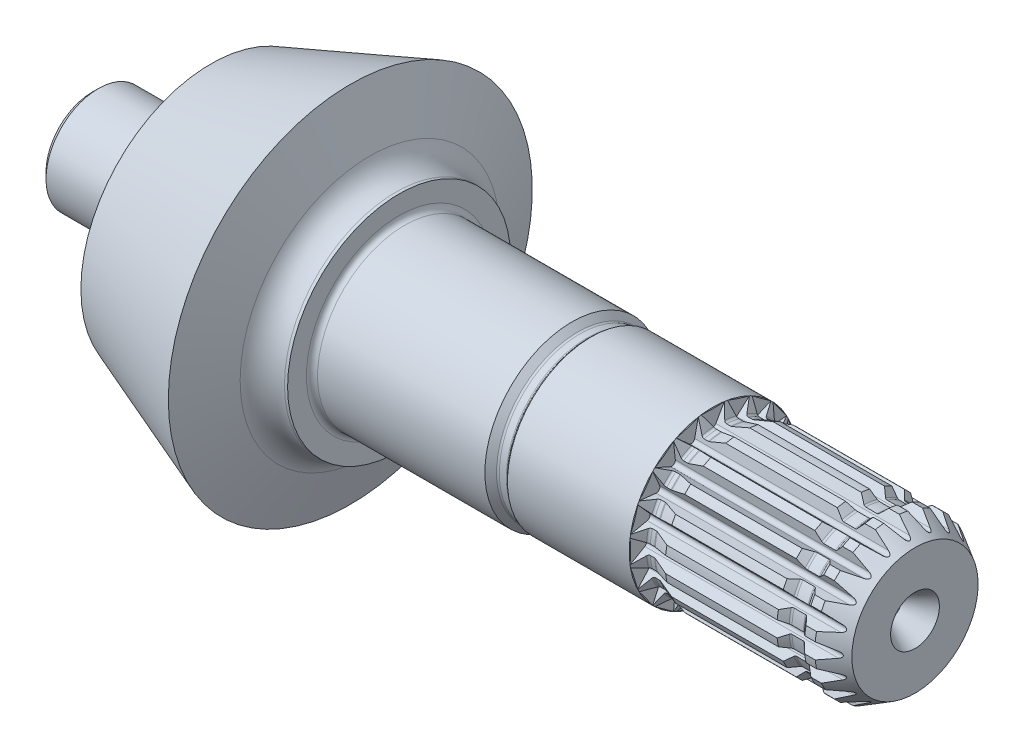
from build123d import *

# Parameters (mm, degrees)
CANNELURE_ROUL_E_DEPTH = 29
F_20_CANNELURES_COUNT  = 20
PER_AGE2_D             = 3
PER_AGE2_DEPTH         = 6
PER_AGE2_CSINK_D       = 6
PER_AGE2_CSINK_ANGLE   = 60
PER_AGE2_TIP           = 0.866025404
PER_AGE3_D             = 3
PER_AGE3_DEPTH         = 8
PER_AGE3_CSINK_D       = 7
PER_AGE3_CSINK_ANGLE   = 60
PER_AGE3_TIP           = 0.866025404


with BuildPart() as part:
    # Esquisse1 → bauche pignon (revolve)
    with BuildSketch(Plane.XY, mode=Mode.PRIVATE) as bauche_pignon_sk:
        with BuildLine():
            Line((-9.286495037, 10), (7.713504963, 10))
            Line((7.713504963, 10), (7.713504963, 18.647686147))
            Line((7.713504963, 18.647686147), (27.713504963, 26.106760606))
            Line((27.713504963, 26.106760606), (30.512346811, 18.602232094))
            ThreePointArc((30.512346811, 18.602232094), (31.978849357, 16.71434393), (34.260178835, 16))
            Line((34.260178835, 16), (108.713504963, 16))
            Line((108.713504963, 16), (108.713504963, 0))
            Line((108.713504963, 0), (-9.286495037, 0))
            Line((-9.286495037, 0), (-9.286495037, 10))
        make_face()
    revolve(bauche_pignon_sk.sketch.rotate(Axis((0, 0, 0), (1, 0, 0)), 85.548664013), axis=Axis((0, 0, 0), (1, 0, 0)))

    # profil tournage queue → tournage queue (revolve, cut)
    with BuildSketch(Plane.XY, mode=Mode.PRIVATE) as tournage_queue_sk:
        with BuildLine():
            Line((34.713504963, 20.351720967), (34.713504963, 13.3))
            ThreePointArc((34.713504963, 13.3), (34.947819538, 12.734314575), (35.513504963, 12.5))
            Line((35.513504963, 12.5), (59.513504963, 12.5))
            Line((59.513504963, 12.5), (60.347203715, 11.666301248))
            ThreePointArc((60.347203715, 11.666301248), (60.476973055, 11.579592147), (60.630046428, 11.54914396))
            Line((60.630046428, 11.54914396), (61.630046428, 11.54914396))
            ThreePointArc((61.630046428, 11.54914396), (61.780299945, 11.57843669), (61.908546784, 11.662024558))
            Line((61.908546784, 11.662024558), (62.256981911, 12))
            Line((62.256981911, 12), (79.713504963, 12))
            Line((79.713504963, 12), (80.617568488, 10.434116042))
            ThreePointArc((80.617568488, 10.434116042), (80.763978649, 10.287705881), (80.963978649, 10.234116042))
            Line((80.963978649, 10.234116042), (81.57132891, 10.234116042))
            ThreePointArc((81.57132891, 10.234116042), (81.636706077, 10.239494925), (81.700324963, 10.255486912))
            Line((81.700324963, 10.255486912), (83.885619278, 11))
            Line((83.885619278, 11), (99.885619278, 11))
            Line((99.885619278, 11), (100.768461991, 10.117157288))
            ThreePointArc((100.768461991, 10.117157288), (100.89823133, 10.030448187), (101.051304703, 10))
            Line((101.051304703, 10), (102.681325933, 10))
            ThreePointArc((102.681325933, 10), (102.834399306, 10.030448187), (102.964168646, 10.117157288))
            Line((102.964168646, 10.117157288), (103.847011358, 11))
            Line((103.847011358, 11), (105.347011358, 11))
            Line((105.347011358, 11), (111.530048212, 7.430222008))
            Line((111.530048212, 7.430222008), (114.713504963, 7.430222008))
            Line((114.713504963, 7.430222008), (114.713504963, 20.351720967))
            Line((114.713504963, 20.351720967), (34.713504963, 20.351720967))
        make_face()
    revolve(tournage_queue_sk.sketch.rotate(Axis((130.23818408, 0, 0), (-1, 0, 0)), 274.451335987), axis=Axis((130.23818408, 0, 0), (-1, 0, 0)), mode=Mode.SUBTRACT)

    # profil avant → contournage avant pignon (revolve, cut)
    with BuildSketch(Plane.XY, mode=Mode.PRIVATE) as contournage_avant_pignon_sk:
        with BuildLine():
            Line((7.213504963, 10.581122951), (7.713504963, 11.081122951))
            Line((7.713504963, 11.081122951), (7.713504963, 22.274596763))
            Line((7.713504963, 22.274596763), (-12.286495037, 22.274596763))
            Line((-12.286495037, 22.274596763), (-12.286495037, 6))
            Line((-12.286495037, 6), (-9.93921977, 6))
            Line((-9.93921977, 6), (-8.43921977, 7.5))
            Line((-8.43921977, 7.5), (6.06078023, 7.5))
            Line((6.06078023, 7.5), (6.06078023, 8.5))
            Line((6.06078023, 8.5), (6.213504963, 8.5))
            ThreePointArc((6.213504963, 8.5), (6.920611744, 8.792893219), (7.213504963, 9.5))
            Line((7.213504963, 9.5), (7.213504963, 10.581122951))
        make_face()
    revolve(contournage_avant_pignon_sk.sketch.rotate(Axis((2.057051701, 0, 0), (1, 0, 0)), 85.548664013), axis=Axis((2.057051701, 0, 0), (1, 0, 0)), mode=Mode.SUBTRACT)

    # section cannelure → cannelure roulée (cut)
    with BuildSketch(Plane(origin=(108.713504963, 0, 0), x_dir=(0, 0, -1), z_dir=(1, 0, 0))):
        with BuildLine():
            Line((0.433012702, 9.75), (1.657867208, 11.871510236))
            Line((1.657867208, 11.871510236), (-1.657867208, 11.871510236))
            Line((-1.657867208, 11.871510236), (-0.433012702, 9.75))
            ThreePointArc((-0.433012702, 9.75), (0, 9.5), (0.433012702, 9.75))
        make_face()
    cannelure_roul_e = extrude(amount=-CANNELURE_ROUL_E_DEPTH, mode=Mode.SUBTRACT)

    # 20 cannelures: cannelure roulée ×20 about axis
    f_20_cannelures_axis = Axis((0, 0, 0), (1, 0, 0))
    for i in range(1, F_20_CANNELURES_COUNT):
        add(cannelure_roul_e.rotate(f_20_cannelures_axis, i * 360 / F_20_CANNELURES_COUNT), mode=Mode.SUBTRACT)

    # Perçage2
    with Locations(Plane.ZY.offset(9.286495037)):
        with Locations((0, 0)):
            CounterSinkHole(PER_AGE2_D / 2, PER_AGE2_CSINK_D / 2, depth=PER_AGE2_DEPTH, counter_sink_angle=PER_AGE2_CSINK_ANGLE)
            with Locations((0, 0, -(PER_AGE2_DEPTH + PER_AGE2_TIP / 2))):  # 120° drill point
                Cone(0, PER_AGE2_D / 2, PER_AGE2_TIP, mode=Mode.SUBTRACT)

    # Perçage3
    with Locations(Plane(origin=(108.713504963, 0, 0), x_dir=(0, 0, -1), z_dir=(1, 0, 0))):
        with Locations((0, 0)):
            CounterSinkHole(PER_AGE3_D / 2, PER_AGE3_CSINK_D / 2, depth=PER_AGE3_DEPTH, counter_sink_angle=PER_AGE3_CSINK_ANGLE)
            with Locations((0, 0, -(PER_AGE3_DEPTH + PER_AGE3_TIP / 2))):  # 120° drill point
                Cone(0, PER_AGE3_D / 2, PER_AGE3_TIP, mode=Mode.SUBTRACT)


solid = part.part
